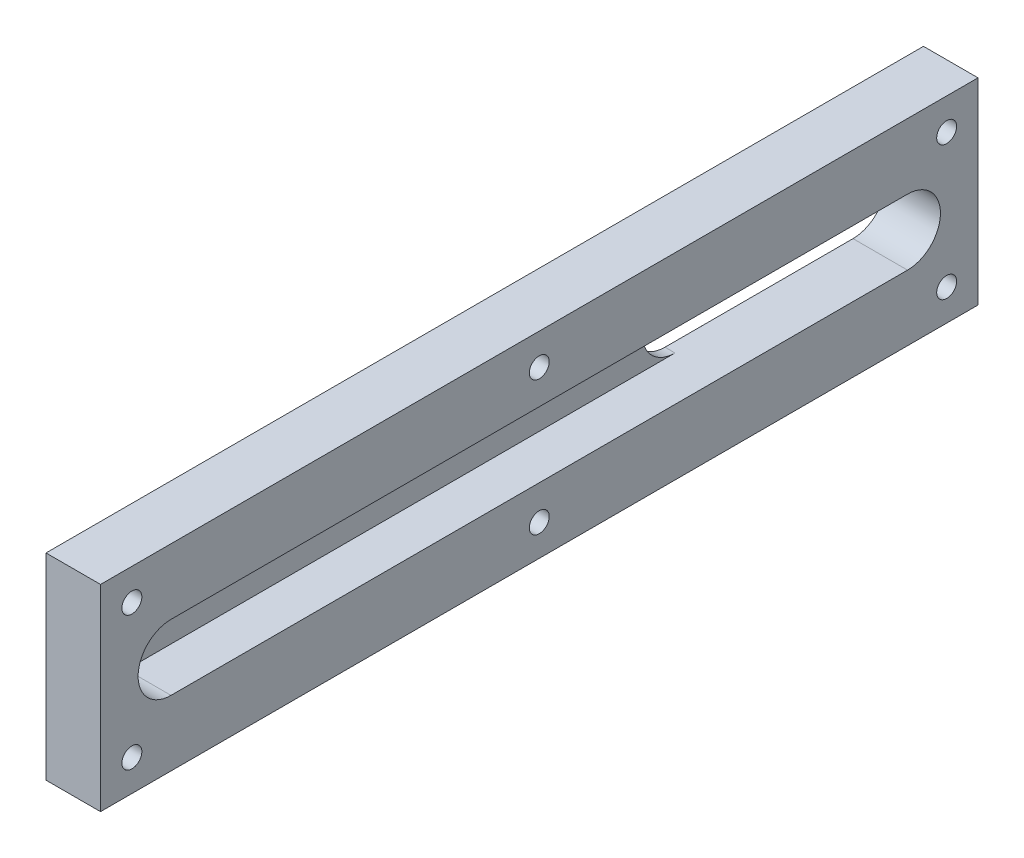
from build123d import *

# Parameters (mm, degrees)
SKETCH1_W              = 177.8
SKETCH1_H              = 39.878
BOSS_EXTRUDE1_DEPTH    = 11.049
F_10_32_TAPPED_HOLE1_D = 4.0386
BOSS_EXTRUDE2_DEPTH    = 2.032


with BuildPart() as part:
    # Sketch1 → Boss-Extrude1 (new body)
    with BuildSketch(Plane(origin=(0, 0, 0), x_dir=(0, 0, -1), z_dir=(1, 0, 0))):
        Rectangle(SKETCH1_W, SKETCH1_H)
        with BuildLine():
            Line((-74.621306688, 6.6675), (74.621306688, 6.6675))
            ThreePointArc((74.621306688, 6.6675), (81.288806688, 0), (74.621306688, -6.6675))
            Line((74.621306688, -6.6675), (-74.621306688, -6.6675))
            ThreePointArc((-74.621306688, -6.6675), (-81.288806688, 0), (-74.621306688, 6.6675))
        make_face(mode=Mode.SUBTRACT)
    extrude(amount=BOSS_EXTRUDE1_DEPTH)

    # #10-32 Tapped Hole1 (through all)
    with Locations(Plane(origin=(11.049, 0, 0), x_dir=(0, 0, -1), z_dir=(1, 0, 0))):
        with Locations((-82.55, 13.589), (-82.55, -13.589), (0, -13.589), (82.55, -13.589), (82.55, 13.589), (0, 13.589)):
            Hole(F_10_32_TAPPED_HOLE1_D / 2)

    # Sketch5 → Boss-Extrude2 (add)
    with BuildSketch(Plane.ZY):
        with BuildLine():
            Line((-36.521306688, -6.6675), (74.621306688, -6.6675))
            ThreePointArc((74.621306688, -6.6675), (81.288806688, 0), (74.621306688, 6.6675))
            Line((74.621306688, 6.6675), (-36.521306688, 6.6675))
            ThreePointArc((-36.521306688, 6.6675), (-29.853806688, 0), (-36.521306688, -6.6675))
        make_face()
    extrude(amount=-BOSS_EXTRUDE2_DEPTH)


solid = part.part
